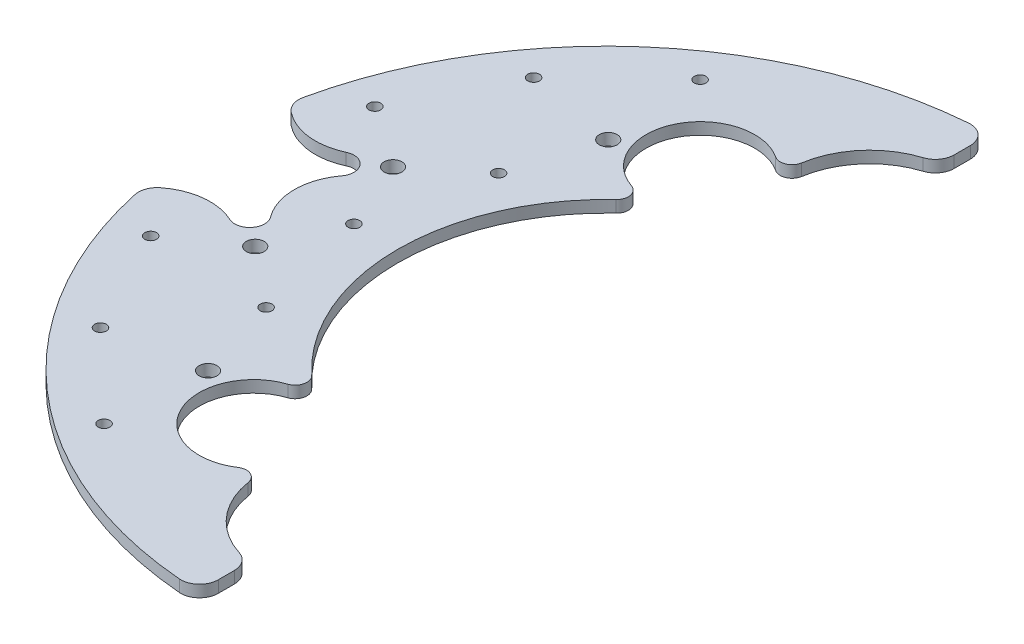
from build123d import *

# Parameters (mm, degrees)
SKETCH2_R           = 0.79375
SKETCH2_R_2         = 1.2065
BOSS_EXTRUDE1_DEPTH = 1.6


with BuildPart() as part:
    # Sketch2 → Boss-Extrude1 (new body)
    with BuildSketch(Plane(origin=(0, 0, 0), x_dir=(1, 0, 0), z_dir=(0, 1, 0))):
        with BuildLine():
            Line((-1.5875, 48.732377473), (-1.5875, 50.912554448))
            ThreePointArc((-1.5875, 50.912554448), (-2.405542288, 52.779761356), (-4.332745385, 53.444248412))
            ThreePointArc((-4.332745385, 53.444248412), (-35.306836043, 40.354525144), (-52.395068561, 11.393733429))
            ThreePointArc((-52.395068561, 11.393733429), (-52.305343014, 10.000391507), (-51.492756078, 8.864981951))
            ThreePointArc((-51.492756078, 8.864981951), (-47.415865481, 7.171089887), (-43.058200955, 7.878950847))
            ThreePointArc((-43.058200955, 7.878950847), (-40.630358405, 7.324125051), (-40.580789574, 4.834186489))
            ThreePointArc((-40.580789574, 4.834186489), (-42.191393903, 0), (-40.580789574, -4.834186489))
            ThreePointArc((-40.580789574, -4.834186489), (-40.630358405, -7.324125051), (-43.058200955, -7.878950847))
            ThreePointArc((-43.058200955, -7.878950847), (-47.415865481, -7.171089887), (-51.492756078, -8.864981951))
            ThreePointArc((-51.492756078, -8.864981951), (-52.305343014, -10.000391507), (-52.395068561, -11.393733429))
            ThreePointArc((-52.395068561, -11.393733429), (-35.306836043, -40.354525144), (-4.332745385, -53.444248412))
            ThreePointArc((-4.332745385, -53.444248412), (-2.405542288, -52.779761356), (-1.5875, -50.912554448))
            Line((-1.5875, -50.912554448), (-1.5875, -48.732377473))
            ThreePointArc((-1.5875, -48.732377473), (-2.077855675, -47.232191438), (-3.359593023, -46.311237478))
            ThreePointArc((-3.359593023, -46.311237478), (-8.418901259, -42.972008429), (-10.972940557, -37.474378601))
            ThreePointArc((-10.972940557, -37.474378601), (-11.900363007, -36.272469223), (-13.41319791, -36.399075336))
            ThreePointArc((-13.41319791, -36.399075336), (-24.083249547, -33.474502145), (-19.817234122, -23.266454208))
            ThreePointArc((-19.817234122, -23.266454208), (-18.773073396, -22.097738961), (-19.241161334, -20.602058302))
            ThreePointArc((-19.241161334, -20.602058302), (-28.189840294, 0), (-19.241161334, 20.602058302))
            ThreePointArc((-19.241161334, 20.602058302), (-18.773073396, 22.097738961), (-19.817234122, 23.266454208))
            ThreePointArc((-19.817234122, 23.266454208), (-24.083249547, 33.474502145), (-13.41319791, 36.399075336))
            ThreePointArc((-13.41319791, 36.399075336), (-11.900363007, 36.272469223), (-10.972940557, 37.474378601))
            ThreePointArc((-10.972940557, 37.474378601), (-8.418901259, 42.972008429), (-3.359593023, 46.311237478))
            ThreePointArc((-3.359593023, 46.311237478), (-2.077855675, 47.232191438), (-1.5875, 48.732377473))
        make_face()
        with Locations(Location((-39.125436229, 29.324414144, 0), (0, 0, 270))):
            Circle(SKETCH2_R, mode=Mode.SUBTRACT)
        with Locations(Location((-30.283799979, -15.742734369, 0), (0, 0, 270))):
            Circle(SKETCH2_R, mode=Mode.SUBTRACT)
        with Locations(Location((-46.479977899, -15.176715045, 0), (0, 0, 270))):
            Circle(SKETCH2_R, mode=Mode.SUBTRACT)
        with Locations(Location((-34.13125, 0, 0), (0, 0, 270))):
            Circle(SKETCH2_R, mode=Mode.SUBTRACT)
        with Locations(Location((-46.479977899, 15.176715045, 0), (0, 0, 270))):
            Circle(SKETCH2_R, mode=Mode.SUBTRACT)
        with Locations(Location((-30.283799979, 15.742734369, 0), (0, 0, 270))):
            Circle(SKETCH2_R, mode=Mode.SUBTRACT)
        with Locations(Location((-38.167598541, -9.327981047, 0), (0, 0, 270))):
            Circle(SKETCH2_R_2, mode=Mode.SUBTRACT)
        with Locations(Location((-38.167598541, 9.327981047, 0), (0, 0, 270))):
            Circle(SKETCH2_R_2, mode=Mode.SUBTRACT)
        with Locations(Location((-26.788483085, 27.092197659, 0), (0, 0, 270))):
            Circle(SKETCH2_R_2, mode=Mode.SUBTRACT)
        with Locations(Location((-27.610010923, 40.353541627, 0), (0, 0, 270))):
            Circle(SKETCH2_R, mode=Mode.SUBTRACT)
        with Locations(Location((-39.125436229, -29.324414144, 0), (0, 0, 270))):
            Circle(SKETCH2_R, mode=Mode.SUBTRACT)
        with Locations(Location((-26.788483085, -27.092197659, 0), (0, 0, 270))):
            Circle(SKETCH2_R_2, mode=Mode.SUBTRACT)
        with Locations(Location((-27.610010923, -40.353541627, 0), (0, 0, 270))):
            Circle(SKETCH2_R, mode=Mode.SUBTRACT)
    extrude(amount=BOSS_EXTRUDE1_DEPTH)


solid = part.part
